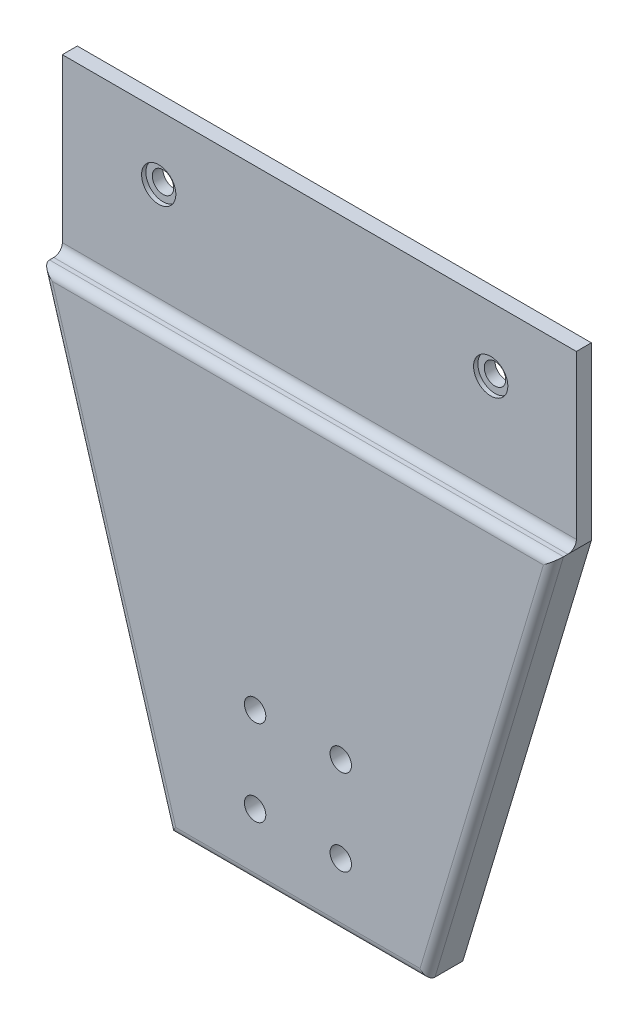
from build123d import *

# Parameters (mm, degrees)
BOSS_EXTRUDE1_DEPTH = 10.795
SKETCH2_W           = 152.4
SKETCH2_H           = 4.445
BOSS_EXTRUDE2_DEPTH = 50.8
SKETCH3_R           = 3.175
CUT_EXTRUDE1_DEPTH  = 495.317625141
FILLET1_R           = 2.54
FILLET2_R           = 2.54
SKETCH4_R           = 5.08
CUT_EXTRUDE2_DEPTH  = 1.27


with BuildPart() as part:
    # Sketch1 → Boss-Extrude1 (new body)
    with BuildSketch(Plane.XY):
        Polygon((228.6, -311.15), (190.5, -438.15), (114.3, -438.15), (76.2, -311.15), align=None)
    extrude(amount=-BOSS_EXTRUDE1_DEPTH)

    # Sketch2 → Boss-Extrude2 (add)
    with BuildSketch(Plane(origin=(0, -311.15, 0), x_dir=(1, 0, 0), z_dir=(0, 1, 0))):
        with Locations((152.4, 8.5725)):
            Rectangle(SKETCH2_W, SKETCH2_H)
    extrude(amount=BOSS_EXTRUDE2_DEPTH)

    # Sketch3 → Cut-Extrude1 (cut, through all)
    with BuildSketch(Plane(origin=(0, 0, -10.795), x_dir=(-1, 0, 0), z_dir=(0, 0, -1))):
        with Locations((-104.775, -279.4)):
            Circle(SKETCH3_R)
        with Locations((-203.2, -279.4)):
            Circle(SKETCH3_R)
        with Locations((-139.7, -393.7)):
            Circle(SKETCH3_R)
        with Locations((-165.1, -393.7)):
            Circle(SKETCH3_R)
        with Locations((-139.7, -419.1)):
            Circle(SKETCH3_R)
        with Locations((-165.1, -419.1)):
            Circle(SKETCH3_R)
    extrude(amount=-CUT_EXTRUDE1_DEPTH, mode=Mode.SUBTRACT)

    # Fillet1
    fillet1_edges = [part.edges().sort_by_distance(p)[0] for p in [
        (152.4, -311.15, -6.35),
    ]]
    fillet(fillet1_edges, radius=FILLET1_R)

    # Fillet2
    fillet2_edges = [part.edges().sort_by_distance(p)[0] for p in [
        (209.55, -374.65, 0),
        (152.4, -438.15, 0),
        (95.25, -374.65, 0),
        (152.4, -311.15, 0),
    ]]
    fillet(fillet2_edges, radius=FILLET2_R)

    # Sketch4 → Cut-Extrude2 (cut)
    with BuildSketch(Plane.XY.offset(-6.35)):
        with Locations((104.775, -279.4)):
            Circle(SKETCH4_R)
        with Locations((203.2, -279.4)):
            Circle(SKETCH4_R)
    extrude(amount=-CUT_EXTRUDE2_DEPTH, mode=Mode.SUBTRACT)


solid = part.part
